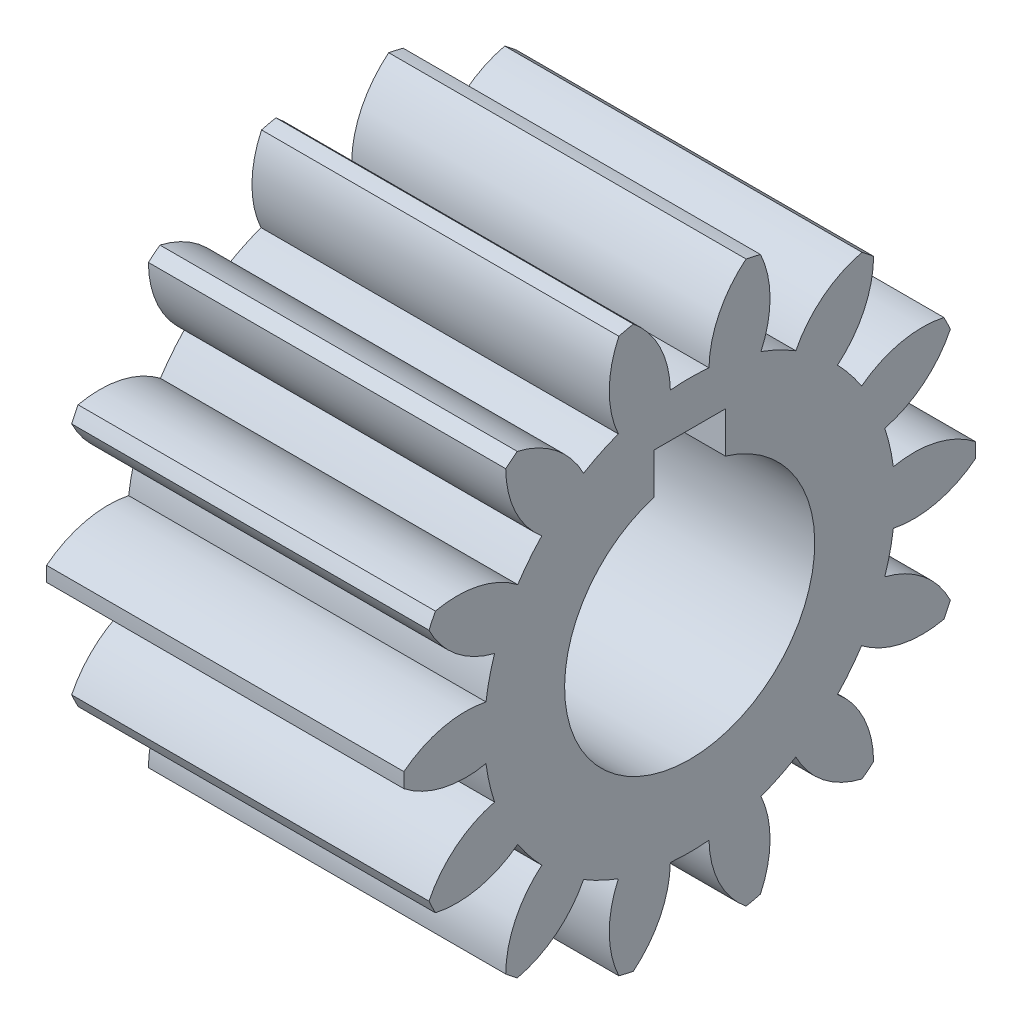
from build123d import *

# Parameters (mm, degrees)
BASPROSKE_W        = 10
BASPROSKE_H        = 8
TOOTHCUT_DEPTH     = 16.099668871
TEETHCUTS_COUNT    = 14
TEETHCUTS_ANGLE    = 334.285714286
BORSKE_R           = 0.4
BORE_DEPTH         = 50.0000508
SKETCH1_R          = 3.5
CUT_EXTRUDE1_DEPTH = 10
SKETCH2_W          = 2
SKETCH2_H          = 2
CUT_EXTRUDE2_DEPTH = 10


with BuildPart() as part:
    # BasProSke → Base-Revolve (revolve)
    with BuildSketch(Plane(origin=(0, 0, 0), x_dir=(1, 0, 0), z_dir=(0, 1, 0)), mode=Mode.PRIVATE) as base_revolve_sk:
        with Locations((5, 4)):
            Rectangle(BASPROSKE_W, BASPROSKE_H)
    revolve(base_revolve_sk.sketch.rotate(Axis((-10, 0, 0), (1, 0, 0)), 180), axis=Axis((-10, 0, 0), (1, 0, 0)))

    # TooCutSke → ToothCut (cut, through all)
    with BuildSketch(Plane(origin=(0, 0, 0), x_dir=(0, 0, -1), z_dir=(1, 0, 0))):
        with BuildLine():
            ThreePointArc((0.540393256, 5.723545765), (0, 5.749), (-0.540393256, 5.723545765))
            ThreePointArc((-0.540393256, 5.723545765), (-0.832220085, 6.912663993), (-1.603550271, 7.863566092))
            ThreePointArc((-1.603550271, 7.863566092), (0, 8.0254), (1.603550271, 7.863566092))
            ThreePointArc((1.603550271, 7.863566092), (0.832220085, 6.912663993), (0.540393256, 5.723545765))
        make_face()
    toothcut = extrude(amount=TOOTHCUT_DEPTH, mode=Mode.SUBTRACT)

    # TeethCuts: ToothCut ×14 about axis
    teethcuts_axis = Axis((-10, 0, 0), (1, 0, 0))
    for i in range(1, TEETHCUTS_COUNT):
        add(toothcut.rotate(teethcuts_axis, i * TEETHCUTS_ANGLE / (TEETHCUTS_COUNT - 1)), mode=Mode.SUBTRACT)

    # BorSke → Bore (cut, symmetric)
    with BuildSketch(Plane(origin=(0, 0, 0), x_dir=(0, 0, -1), z_dir=(1, 0, 0))):
        with Locations(Location((0, 0, 0), (0, 0, 180))):
            Circle(BORSKE_R)
    extrude(amount=BORE_DEPTH, both=True, mode=Mode.SUBTRACT)

    # Sketch1 → Cut-Extrude1 (cut)
    with BuildSketch(Plane(origin=(10, 0, 0), x_dir=(0, 0, -1), z_dir=(1, 0, 0))):
        Circle(SKETCH1_R)
    extrude(amount=-CUT_EXTRUDE1_DEPTH, mode=Mode.SUBTRACT)

    # Sketch2 → Cut-Extrude2 (cut)
    with BuildSketch(Plane(origin=(10, 0, 0), x_dir=(0, 0, -1), z_dir=(1, 0, 0))):
        with Locations((0, 3.5)):
            Rectangle(SKETCH2_W, SKETCH2_H)
    extrude(amount=-CUT_EXTRUDE2_DEPTH, mode=Mode.SUBTRACT)


solid = part.part
